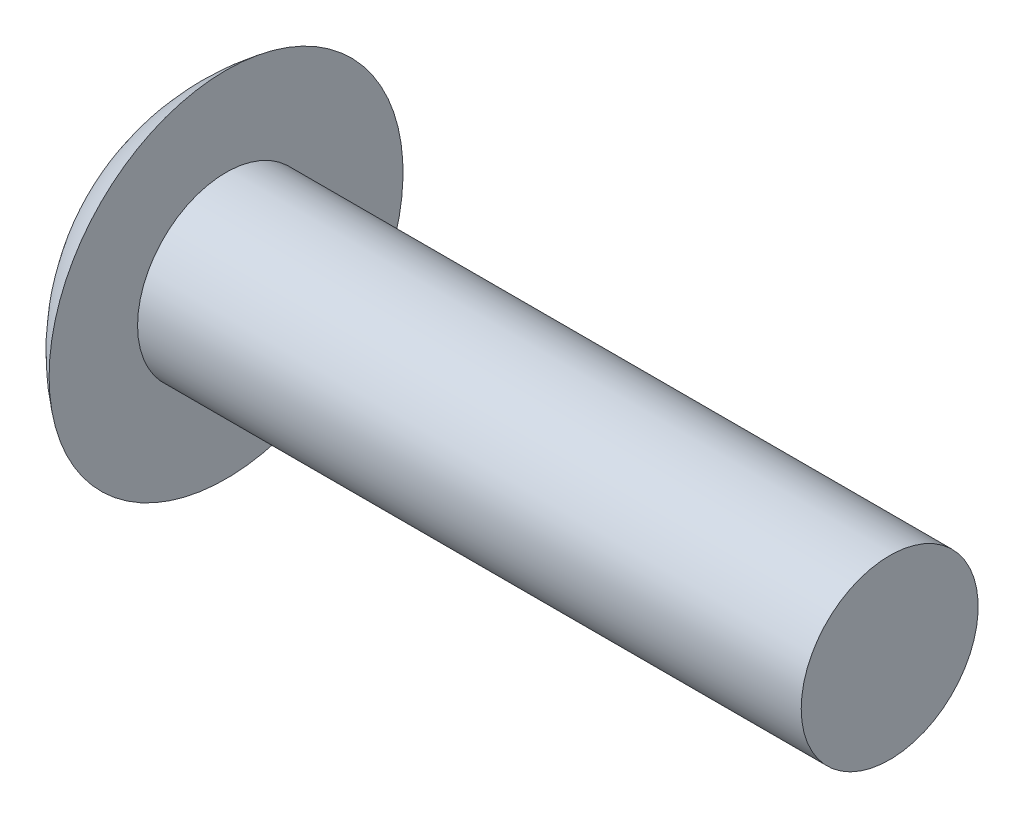
from build123d import *


with BuildPart() as part:
    # Sketch1 → Revolve1 (revolve)
    with BuildSketch(Plane.XY):
        with BuildLine():
            Line((0, 0), (17, 0))
            Line((17, 0), (17, 2))
            Line((17, 2), (2, 2))
            Line((2, 2), (2, 4))
            ThreePointArc((2, 4), (0.527864045, 2.236067977), (0, 0))
        make_face()
    revolve(axis=Axis((0, 0, 0), (1, 0, 0)))


solid = part.part
